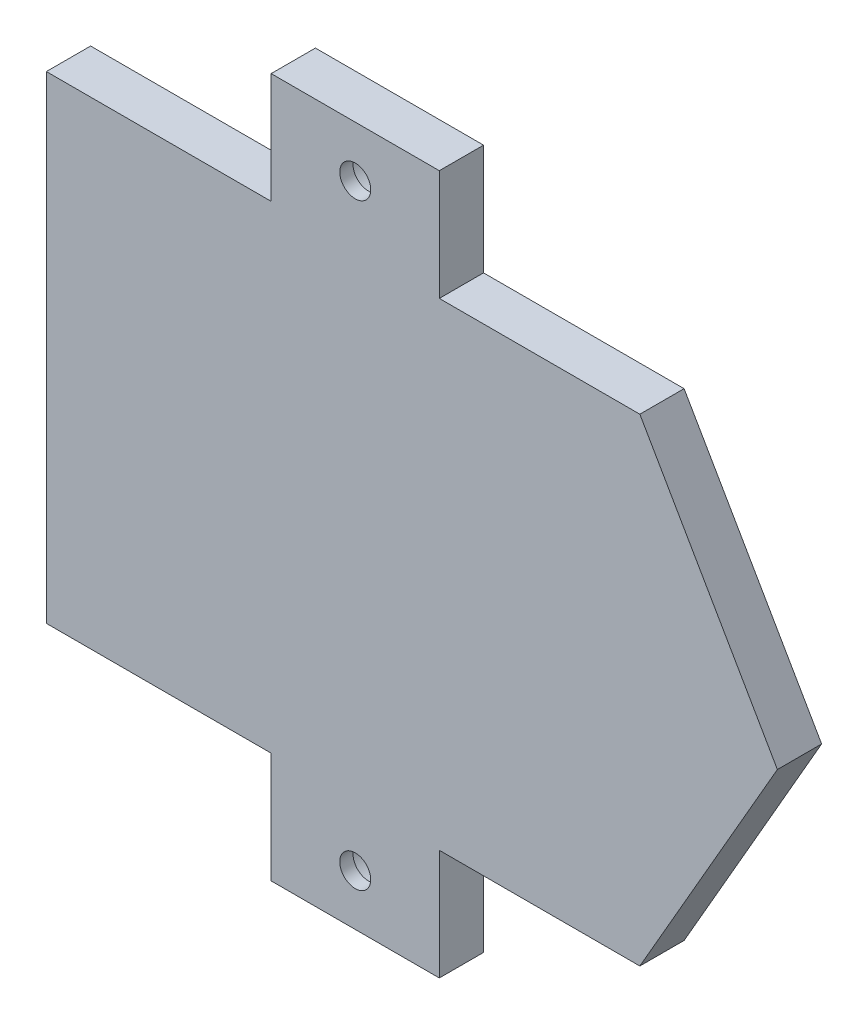
from build123d import *

# Parameters (mm, degrees)
BOSS_EXTRUDE2_DEPTH     = 5
CUT_EXTRUDE6_DEPTH      = 131.001332273
CUT_EXTRUDE2_DEPTH      = 130.239475323
CUT_EXTRUDE2_DEPTH_BACK = 130.239475323
SKETCH2_R               = 1.75
SKETCH2_3_R             = 3.5
SKETCH2_3_R_2           = 1.75
CUT_EXTRUDE4_DEPTH      = 3.5


with BuildPart() as part:
    # Sketch1 → Boss-Extrude2 (new body)
    with BuildSketch(Plane.XY):
        Polygon((35.4, 77.5), (10, 77.5), (10, 22.5), (35.4, 22.5), (35.4, 10), (55.4, 10), (55.4, 22.5), (77.847550572, 22.5), (93.676818865, 50), (77.847550572, 77.5), (55.4, 77.5), (55.4, 90), (35.4, 90), align=None)
    extrude(amount=BOSS_EXTRUDE2_DEPTH)

    # Sketch6 → Cut-Extrude6 (cut, through all)
    with BuildSketch(Plane.XY):
        Polygon((55.4, 10), (55.4, 22.5), (77.847550572, 22.5), (93.676818865, 50), (77.847550572, 77.5), (55.4, 77.5), (55.4, 90), (35.4, 90), (35.4, 77.5), (10, 77.5), (10, 22.5), (35.4, 22.5), (35.4, 10), align=None)
        Polygon((77.558439817, 23), (54.9, 23), (54.9, 10.5), (35.9, 10.5), (35.9, 23), (10.5, 23), (10.5, 77), (35.9, 77), (35.9, 89.5), (54.9, 89.5), (54.9, 77), (77.558439817, 77), (93.099903232, 50), align=None, mode=Mode.SUBTRACT)
    extrude(amount=CUT_EXTRUDE6_DEPTH, mode=Mode.SUBTRACT)

    # Sketch2 → Cut-Extrude2 (cut, two sides: drawn at the far end of the back side and taken through both)
    with BuildSketch(Plane.XY.offset(-CUT_EXTRUDE2_DEPTH_BACK)):
        with Locations((45.4, 16.25)):
            Circle(SKETCH2_R)
        with Locations((45.4, 83.75)):
            Circle(SKETCH2_R)
    extrude(amount=CUT_EXTRUDE2_DEPTH + CUT_EXTRUDE2_DEPTH_BACK, mode=Mode.SUBTRACT)

    # Sketch2<3> → Cut-Extrude4 (cut)
    # profile 1 of 2: a face of its own
    with BuildSketch(Plane.XY):
        with Locations((45.4, 83.75)):
            Circle(SKETCH2_3_R)
        with Locations((45.4, 83.75)):
            Circle(SKETCH2_3_R_2, mode=Mode.SUBTRACT)
    # profile 2 of 2: a face of its own
    with BuildSketch(Plane.XY):
        with Locations((45.4, 16.25)):
            Circle(SKETCH2_3_R)
        with Locations((45.4, 16.25)):
            Circle(SKETCH2_3_R_2, mode=Mode.SUBTRACT)
    extrude(amount=CUT_EXTRUDE4_DEPTH, mode=Mode.SUBTRACT)


solid = part.part
